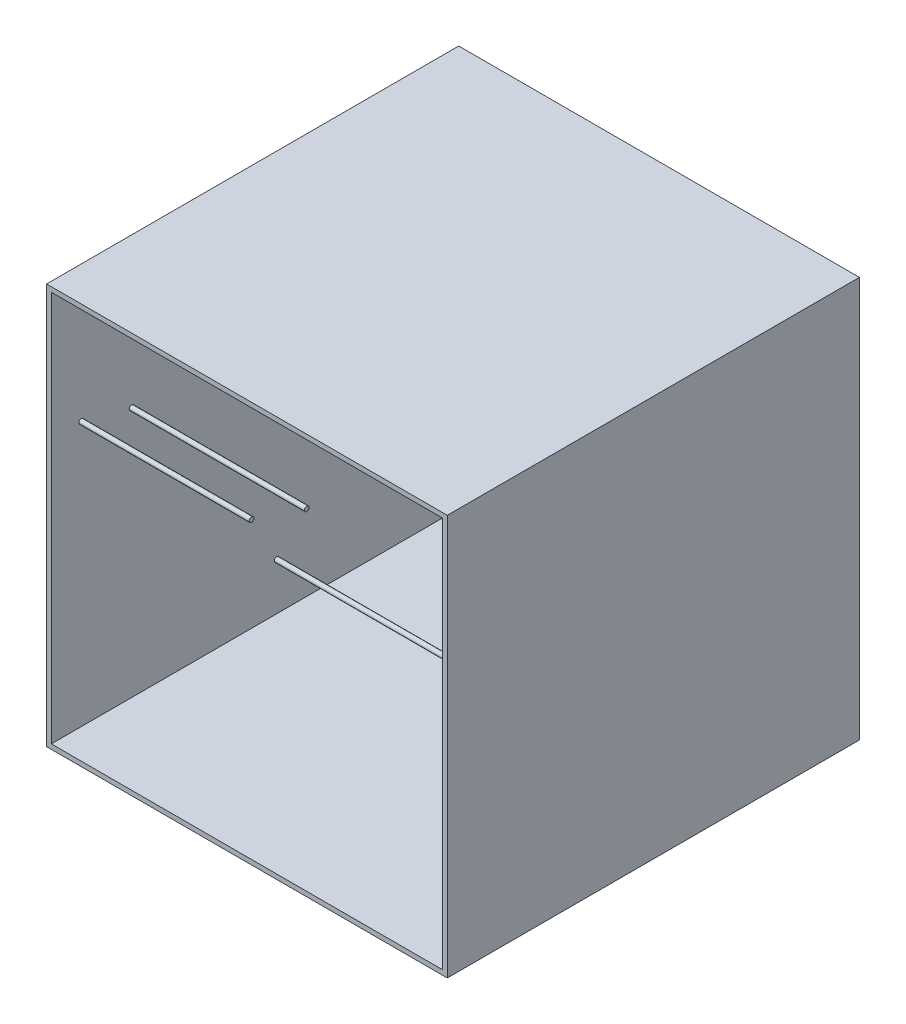
from build123d import *

# Parameters (mm, degrees)
ESBO_O1_W                = 420
ESBO_O1_H                = 420
ESBO_O1_W_2              = 410
ESBO_O1_H_2              = 410
RESSALTO_EXTRUS_O1_DEPTH = 432
ESBO_O4_R                = 2.5
RESSALTO_EXTRUS_O4_DEPTH = 183.55
ESBO_O4_4_R              = 2.5
RESSALTO_EXTRUS_O5_DEPTH = 188.55
ESBO_O5_R                = 2.5
RESSALTO_EXTRUS_O6_DEPTH = 183.45
ESBO_O6_R                = 15
RESSALTO_EXTRUS_O7_DEPTH = 183.45


with BuildPart() as part:
    # Esboço1 → Ressalto-extrusão1 (new body)
    with BuildSketch(Plane.XY):
        Rectangle(ESBO_O1_W, ESBO_O1_H)
        Rectangle(ESBO_O1_W_2, ESBO_O1_H_2, mode=Mode.SUBTRACT)
    extrude(amount=RESSALTO_EXTRUS_O1_DEPTH)

    # Esboço4 → Ressalto-extrusão4 (add)
    with BuildSketch(Plane.ZY.offset(210)):
        with Locations((400.68, 72.17)):
            Circle(ESBO_O4_R)
    extrude(amount=-RESSALTO_EXTRUS_O4_DEPTH)

    # Esboço4<4> → Ressalto-extrusão5 (add)
    with BuildSketch(Plane.ZY.offset(210)):
        with Locations((347.87, 58.16)):
            Circle(ESBO_O4_4_R)
    extrude(amount=-RESSALTO_EXTRUS_O5_DEPTH)

    # Esboço5 → Ressalto-extrusão6 (add)
    with BuildSketch(Plane(origin=(210, 0, 0), x_dir=(0, 0, -1), z_dir=(1, 0, 0))):
        with Locations((-353.49, 138.09)):
            Circle(ESBO_O5_R)
        with Locations((-427.35, 75.92)):
            Circle(ESBO_O5_R)
    extrude(amount=-RESSALTO_EXTRUS_O6_DEPTH)

    # Esboço6 → Ressalto-extrusão7 (add)
    with BuildSketch(Plane.ZY.offset(210)):
        with Locations((150.03, -10.05)):
            Circle(ESBO_O6_R)
    extrude(amount=-RESSALTO_EXTRUS_O7_DEPTH)


solid = part.part
